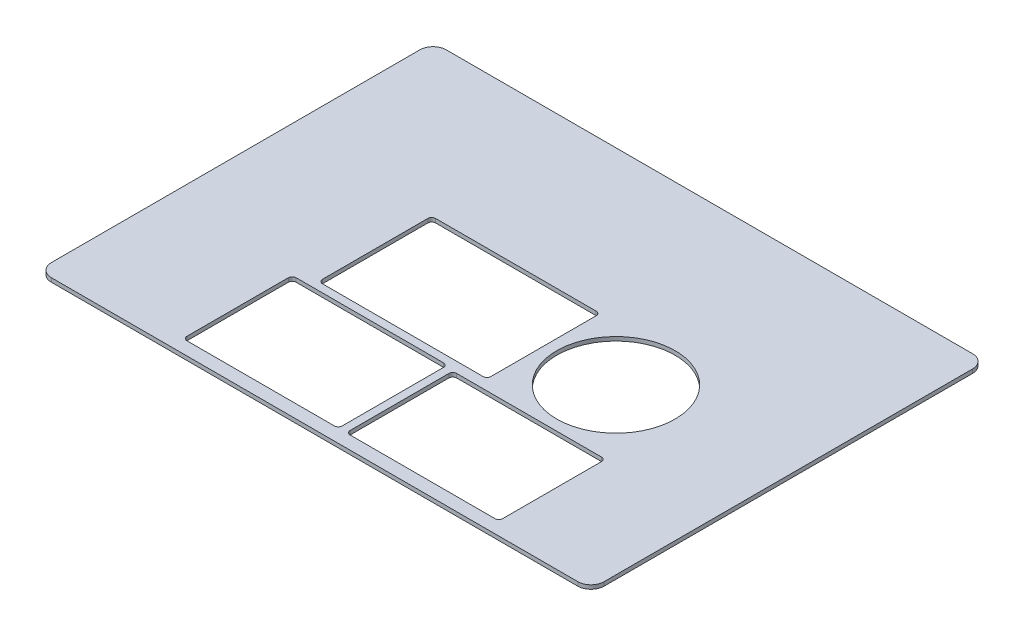
from build123d import *

# Parameters (mm, degrees)
SKETCH_2_W      = 420
SKETCH_2_H      = 300
SKETCH_2_R      = 45
SKETCH_2_W_2    = 116
SKETCH_2_H_2    = 81
SKETCH_2_W_3    = 118
SKETCH_2_H_3    = 83
SKETCH_2_W_4    = 128
SKETCH_2_H_4    = 86
EXTRUDE_2_DEPTH = 3
FILLET_1_R      = 3
FILLET_2_R      = 3
FILLET_3_R      = 3
FILLET_4_R      = 3
FILLET_5_R      = 3
FILLET_6_R      = 3
FILLET_7_R      = 3
FILLET_8_R      = 3
FILLET_9_R      = 3
FILLET_10_R     = 3
FILLET_11_R     = 3
FILLET_12_R     = 3
FILLET_13_R     = 10
FILLET_14_R     = 10
FILLET_15_R     = 10
FILLET_16_R     = 10


with BuildPart() as part:
    # 草图2 → 凸台-拉伸2 (new body)
    with BuildSketch(Plane(origin=(0, 0, 0), x_dir=(1, 0, 0), z_dir=(0, 1, 0))):
        Rectangle(SKETCH_2_W, SKETCH_2_H)
        with Locations(Location((85, -6, 0), (0, 0, 270))):
            Circle(SKETCH_2_R, mode=Mode.SUBTRACT)
        with Locations((72, -99.5)):
            Rectangle(SKETCH_2_W_2, SKETCH_2_H_2, mode=Mode.SUBTRACT)
        with Locations((-51, -98.5)):
            Rectangle(SKETCH_2_W_3, SKETCH_2_H_3, mode=Mode.SUBTRACT)
        with Locations((-32, -8)):
            Rectangle(SKETCH_2_W_4, SKETCH_2_H_4, mode=Mode.SUBTRACT)
    extrude(amount=EXTRUDE_2_DEPTH)

    # 圆角1
    fillet_1_edges = [part.edges().sort_by_distance(p)[0] for p in [
        (-96, 1.5, -35),
    ]]
    fillet(fillet_1_edges, radius=FILLET_1_R)

    # 圆角2
    fillet_2_edges = [part.edges().sort_by_distance(p)[0] for p in [
        (-96, 1.5, 51),
    ]]
    fillet(fillet_2_edges, radius=FILLET_2_R)

    # 圆角3
    fillet_3_edges = [part.edges().sort_by_distance(p)[0] for p in [
        (32, 1.5, 51),
    ]]
    fillet(fillet_3_edges, radius=FILLET_3_R)

    # 圆角4
    fillet_4_edges = [part.edges().sort_by_distance(p)[0] for p in [
        (32, 1.5, -35),
    ]]
    fillet(fillet_4_edges, radius=FILLET_4_R)

    # 圆角5
    fillet_5_edges = [part.edges().sort_by_distance(p)[0] for p in [
        (14, 1.5, 140),
    ]]
    fillet(fillet_5_edges, radius=FILLET_5_R)

    # 圆角6
    fillet_6_edges = [part.edges().sort_by_distance(p)[0] for p in [
        (14, 1.5, 59),
    ]]
    fillet(fillet_6_edges, radius=FILLET_6_R)

    # 圆角7
    fillet_7_edges = [part.edges().sort_by_distance(p)[0] for p in [
        (130, 1.5, 59),
    ]]
    fillet(fillet_7_edges, radius=FILLET_7_R)

    # 圆角8
    fillet_8_edges = [part.edges().sort_by_distance(p)[0] for p in [
        (130, 1.5, 140),
    ]]
    fillet(fillet_8_edges, radius=FILLET_8_R)

    # 圆角9
    fillet_9_edges = [part.edges().sort_by_distance(p)[0] for p in [
        (8, 1.5, 140),
    ]]
    fillet(fillet_9_edges, radius=FILLET_9_R)

    # 圆角10
    fillet_10_edges = [part.edges().sort_by_distance(p)[0] for p in [
        (8, 1.5, 57),
    ]]
    fillet(fillet_10_edges, radius=FILLET_10_R)

    # 圆角11
    fillet_11_edges = [part.edges().sort_by_distance(p)[0] for p in [
        (-110, 1.5, 140),
    ]]
    fillet(fillet_11_edges, radius=FILLET_11_R)

    # 圆角12
    fillet_12_edges = [part.edges().sort_by_distance(p)[0] for p in [
        (-110, 1.5, 57),
    ]]
    fillet(fillet_12_edges, radius=FILLET_12_R)

    # 圆角13
    fillet_13_edges = [part.edges().sort_by_distance(p)[0] for p in [
        (-210, 1.5, 150),
    ]]
    fillet(fillet_13_edges, radius=FILLET_13_R)

    # 圆角14
    fillet_14_edges = [part.edges().sort_by_distance(p)[0] for p in [
        (210, 1.5, 150),
    ]]
    fillet(fillet_14_edges, radius=FILLET_14_R)

    # 圆角15
    fillet_15_edges = [part.edges().sort_by_distance(p)[0] for p in [
        (210, 1.5, -150),
    ]]
    fillet(fillet_15_edges, radius=FILLET_15_R)

    # 圆角16
    fillet_16_edges = [part.edges().sort_by_distance(p)[0] for p in [
        (-210, 1.5, -150),
    ]]
    fillet(fillet_16_edges, radius=FILLET_16_R)


solid = part.part
